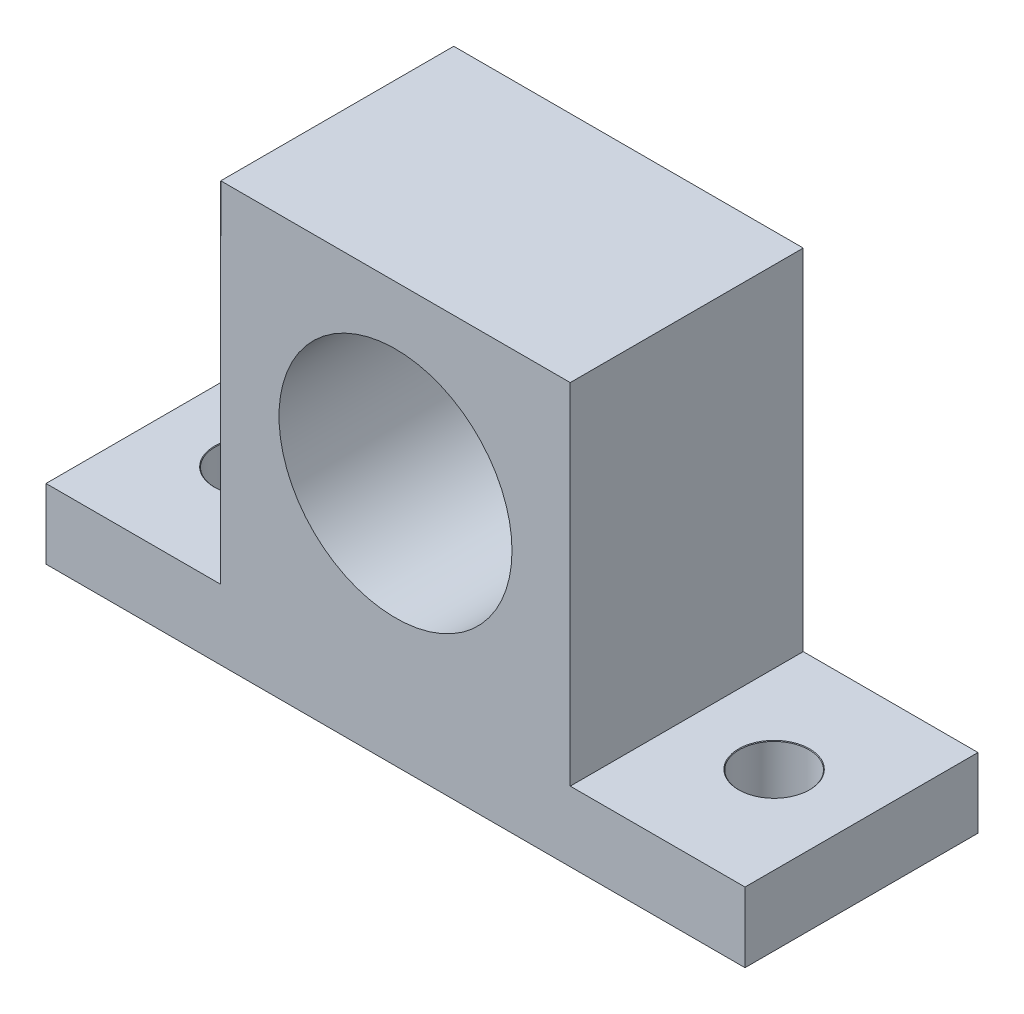
from build123d import *

# Parameters (mm, degrees)
SKETCH1_W                       = 30
SKETCH1_H                       = 10
BOSS_EXTRUDE1_DEPTH             = 3
SKETCH2_W                       = 15
SKETCH2_H                       = 10
BOSS_EXTRUDE2_DEPTH             = 15
SKETCH3_R                       = 5
CUT_EXTRUDE1_DEPTH              = 138.595978597
F_3_0MM_DOWEL_HOLE1_D           = 3
F_3_0MM_DOWEL_HOLE1_CSINK_D     = 3.05
F_3_0MM_DOWEL_HOLE1_CSINK_ANGLE = 90


with BuildPart() as part:
    # Sketch1 → Boss-Extrude1 (new body)
    with BuildSketch(Plane(origin=(0, 0, 0), x_dir=(1, 0, 0), z_dir=(0, 1, 0))):
        with Locations((-121.046511628, -47.823920266)):
            Rectangle(SKETCH1_W, SKETCH1_H)
    extrude(amount=BOSS_EXTRUDE1_DEPTH)

    # Sketch2 → Boss-Extrude2 (add)
    with BuildSketch(Plane(origin=(0, 3, 0), x_dir=(1, 0, 0), z_dir=(0, 1, 0))):
        with Locations((-121.046511628, -47.823920266)):
            Rectangle(SKETCH2_W, SKETCH2_H)
    extrude(amount=BOSS_EXTRUDE2_DEPTH)

    # Sketch3 → Cut-Extrude1 (cut, through all)
    with BuildSketch(Plane.XY.offset(52.823920266)):
        with Locations((-121.046511628, 10.5)):
            Circle(SKETCH3_R)
    extrude(amount=-CUT_EXTRUDE1_DEPTH, mode=Mode.SUBTRACT)

    # Ø3.0mm Dowel Hole1 (through all)
    with Locations(Plane(origin=(0, 3, 0), x_dir=(1, 0, 0), z_dir=(0, 1, 0))):
        with Locations((-132.296511628, -47.823920266)):
            f_3_0mm_dowel_hole1 = CounterSinkHole(F_3_0MM_DOWEL_HOLE1_D / 2, F_3_0MM_DOWEL_HOLE1_CSINK_D / 2, counter_sink_angle=F_3_0MM_DOWEL_HOLE1_CSINK_ANGLE)

    # Mirror1: Ø3.0mm Dowel Hole1 across plane
    add(f_3_0mm_dowel_hole1.mirror(Plane(origin=(-121.046511628, 0, 0), x_dir=(0, 0, 1), z_dir=(1, 0, 0))), mode=Mode.SUBTRACT)


solid = part.part
